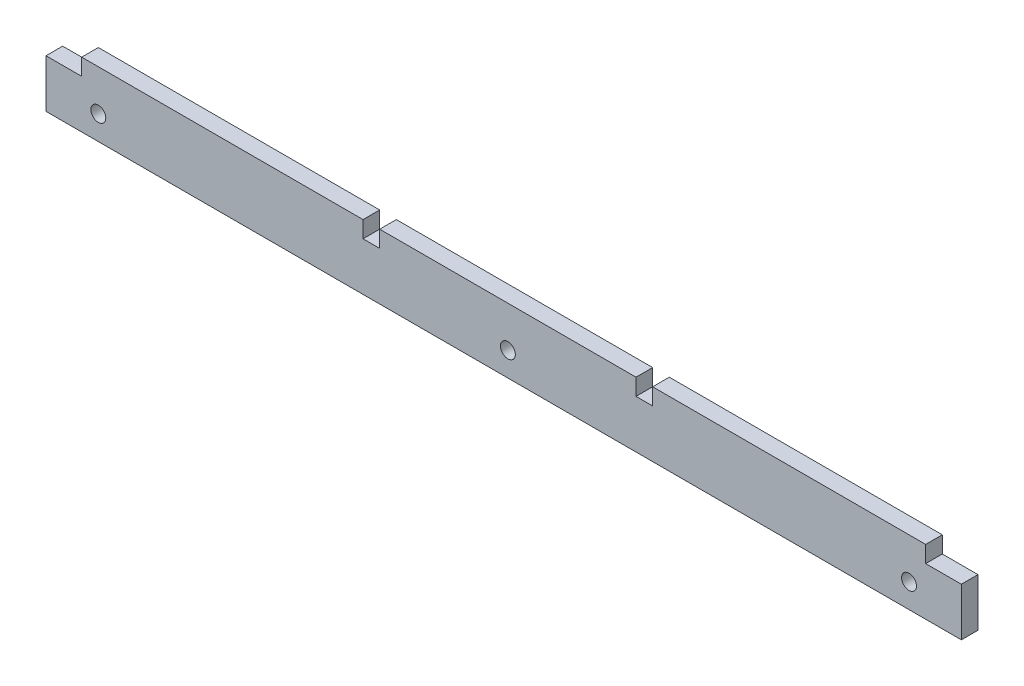
from build123d import *

# Parameters (mm, degrees)
SKETCH1_R           = 1.4224
BOSS_EXTRUDE1_DEPTH = 3.175


with BuildPart() as part:
    # Sketch1 → Boss-Extrude1 (new body)
    with BuildSketch(Plane.XY):
        Polygon((6075.440076302, 2666.732382812), (6075.440076302, 2669.907382812), (6023.357376302, 2669.907382812), (6023.357376302, 2666.732382812), (6020.182376302, 2666.732382812), (6020.182376302, 2669.907382812), (5971.279772433, 2669.907382812), (5971.279772433, 2666.732382812), (5968.104772433, 2666.732382812), (5968.104772433, 2669.907382812), (5914.429476302, 2669.907382812), (5914.429476302, 2666.732382812), (5907.622276302, 2666.732382812), (5907.622276302, 2657.537582812), (6082.247276302, 2657.537582812), (6082.247276302, 2666.732382812), align=None)
        with Locations((5995.731074367, 2662.134982812)):
            Circle(SKETCH1_R, mode=Mode.SUBTRACT)
        with Locations((5917.604476302, 2662.134982812)):
            Circle(SKETCH1_R, mode=Mode.SUBTRACT)
        with Locations((6072.265076302, 2662.134982812)):
            Circle(SKETCH1_R, mode=Mode.SUBTRACT)
    extrude(amount=BOSS_EXTRUDE1_DEPTH)


solid = part.part
